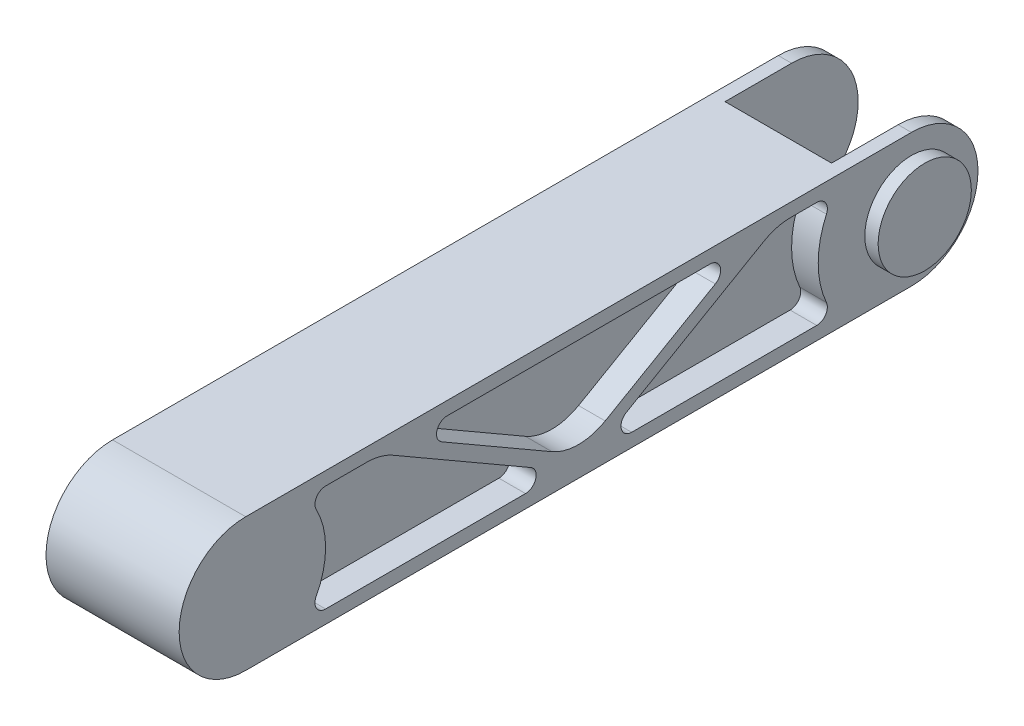
from build123d import *

# Parameters (mm, degrees)
BOSS_EXTRUDE1_DEPTH      = 25
BOSS_EXTRUDE1_DEPTH_BACK = 25
CUT_EXTRUDE1_DEPTH       = 161.078105936
CUT_EXTRUDE1_DEPTH_BACK  = 161.078105936
SKETCH2_W                = 40
SKETCH2_H                = 100
SKETCH3_R                = 17.5
BOSS_EXTRUDE2_DEPTH      = 5
CUT_EXTRUDE2_DEPTH       = 10
FILLET1_R                = 20
FILLET2_R                = 4
FILLET1_OF_MIRROR2_R     = 20
FILLET2_OF_MIRROR2_R     = 4


with BuildPart() as part:
    # Sketch1 → Boss-Extrude1 (new, two sides: drawn at the far end of the back side and taken through both)
    with BuildSketch(Plane(origin=(0, 0, 0), x_dir=(0, 0, -1), z_dir=(1, 0, 0)).offset(-BOSS_EXTRUDE1_DEPTH_BACK)):
        with BuildLine():
            Line((-125, -25), (125, -25))
            ThreePointArc((125, -25), (150, 0), (125, 25))
            Line((125, 25), (-125, 25))
            ThreePointArc((-125, 25), (-150, 0), (-125, -25))
        make_face()
    extrude(amount=BOSS_EXTRUDE1_DEPTH + BOSS_EXTRUDE1_DEPTH_BACK)

    # Sketch2 → Cut-Extrude1 (cut, two sides: drawn at the far end of the back side and taken through both)
    with BuildSketch(Plane(origin=(0, 25, 0), x_dir=(1, 0, 0), z_dir=(0, 1, 0)).offset(-CUT_EXTRUDE1_DEPTH_BACK)):
        with Locations((0, 150)):
            Rectangle(SKETCH2_W, SKETCH2_H)
    extrude(amount=CUT_EXTRUDE1_DEPTH + CUT_EXTRUDE1_DEPTH_BACK, mode=Mode.SUBTRACT)

    # Sketch3 → Boss-Extrude2 (add)
    with BuildSketch(Plane(origin=(25, 0, 0), x_dir=(0, 0, -1), z_dir=(1, 0, 0))):
        with Locations((125, 0)):
            Circle(SKETCH3_R)
    boss_extrude2 = extrude(amount=BOSS_EXTRUDE2_DEPTH)

    # Mirror1: Boss-Extrude2 across plane
    add(boss_extrude2.mirror(Plane(origin=(0, 0, 0), x_dir=(0, 0, 1), z_dir=(1, 0, 0))))

    # Sketch4 → Cut-Extrude2 (cut)
    with BuildSketch(Plane(origin=(25, 0, 0), x_dir=(0, 0, -1), z_dir=(1, 0, 0))):
        with BuildLine():
            ThreePointArc((96.277186767, -20), (90, 0), (96.277186767, 20))
            Line((96.277186767, 20), (74.282032303, 20))
            Line((74.282032303, 20), (5, -20))
            Line((5, -20), (96.277186767, -20))
        make_face()
        Polygon((0, -17.113248654), (64.282032303, 20), (-64.282032303, 20), align=None)
        with BuildLine():
            Line((-102.639320225, -20), (-5, -20))
            Line((-5, -20), (-74.282032303, 20))
            Line((-74.282032303, 20), (-102.639320225, 20))
            ThreePointArc((-102.639320225, 20), (-95, 0), (-102.639320225, -20))
        make_face()
    cut_extrude2 = extrude(amount=-CUT_EXTRUDE2_DEPTH, mode=Mode.SUBTRACT)

    # Fillet1
    fillet1_edges = [part.edges().sort_by_distance(p)[0] for p in [
        (20, -17.113248654, 0),
        (20, 20, -74.282032303),
        (20, 20, 74.282032303),
    ]]
    fillet(fillet1_edges, radius=FILLET1_R)

    # Fillet2
    fillet2_edges = [part.edges().sort_by_distance(p)[0] for p in [
        (20, -20, -96.277186767),
        (20, 20, -96.277186767),
        (20, -20, -5),
        (20, -20, 5),
        (20, -20, 102.639320225),
        (20, 20, 102.639320225),
        (20, 20, -64.282032303),
        (20, 20, 64.282032303),
    ]]
    fillet(fillet2_edges, radius=FILLET2_R)

    # Mirror2: Cut-Extrude2 across plane
    add(cut_extrude2.mirror(Plane(origin=(0, 0, 0), x_dir=(0, 0, 1), z_dir=(1, 0, 0))), mode=Mode.SUBTRACT)

    # Fillet1 of Mirror2
    fillet1_of_mirror2_edges = [part.edges().sort_by_distance(p)[0] for p in [
        (-20, -17.113248654, 0),
        (-20, 20, -74.282032303),
        (-20, 20, 74.282032303),
    ]]
    fillet(fillet1_of_mirror2_edges, radius=FILLET1_OF_MIRROR2_R)

    # Fillet2 of Mirror2
    fillet2_of_mirror2_edges = [part.edges().sort_by_distance(p)[0] for p in [
        (-20, -20, -96.277186767),
        (-20, 20, -96.277186767),
        (-20, -20, -5),
        (-20, -20, 5),
        (-20, -20, 102.639320225),
        (-20, 20, 102.639320225),
        (-20, 20, -64.282032303),
        (-20, 20, 64.282032303),
    ]]
    fillet(fillet2_of_mirror2_edges, radius=FILLET2_OF_MIRROR2_R)


solid = part.part
